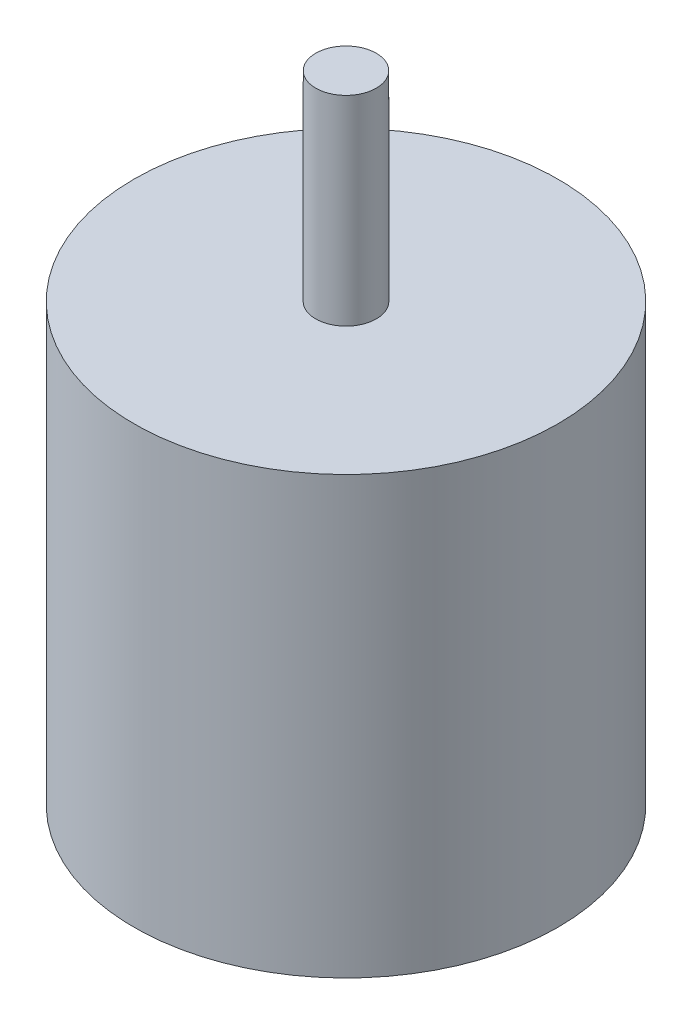
from build123d import *

# Parameters (mm, degrees)
SKETCH2_W           = 17.5
SKETCH2_H           = 36
SKETCH3_R           = 2.5
BOSS_EXTRUDE1_DEPTH = 16.5
SKETCH4_R           = 1.5
SKETCH4_R_2         = 4
CUT_EXTRUDE2_DEPTH  = 5


with BuildPart() as part:
    # Sketch2 → Revolve1 (revolve)
    with BuildSketch(Plane.XY, mode=Mode.PRIVATE) as revolve1_sk:
        with Locations((8.75, 0)):
            Rectangle(SKETCH2_W, SKETCH2_H)
    revolve(revolve1_sk.sketch.rotate(Axis((0, 18, 0), (0, -1, 0)), 180), axis=Axis((0, 18, 0), (0, -1, 0)))

    # Sketch3 → Boss-Extrude1 (add)
    with BuildSketch(Plane(origin=(0, 18, 0), x_dir=(1, 0, 0), z_dir=(0, 1, 0))):
        Circle(SKETCH3_R)
    extrude(amount=BOSS_EXTRUDE1_DEPTH)

    # Sketch4 → Cut-Extrude2 (cut)
    with BuildSketch(Plane.XZ.offset(18)):
        with Locations((0, 9.5)):
            Circle(SKETCH4_R)
        with Locations((0, -9.5)):
            Circle(SKETCH4_R)
        with Locations((12.5, 0)):
            Circle(SKETCH4_R)
        with Locations((-12.5, 0)):
            Circle(SKETCH4_R)
        with Locations((-8.838834765, 8.838834765)):
            Circle(SKETCH4_R_2)
        with Locations((8.838834765, -8.838834765)):
            Circle(SKETCH4_R_2)
        with Locations((-8.838834765, -8.838834765)):
            Circle(SKETCH4_R_2)
        with Locations((8.838834765, 8.838834765)):
            Circle(SKETCH4_R_2)
    extrude(amount=-CUT_EXTRUDE2_DEPTH, mode=Mode.SUBTRACT)


solid = part.part
